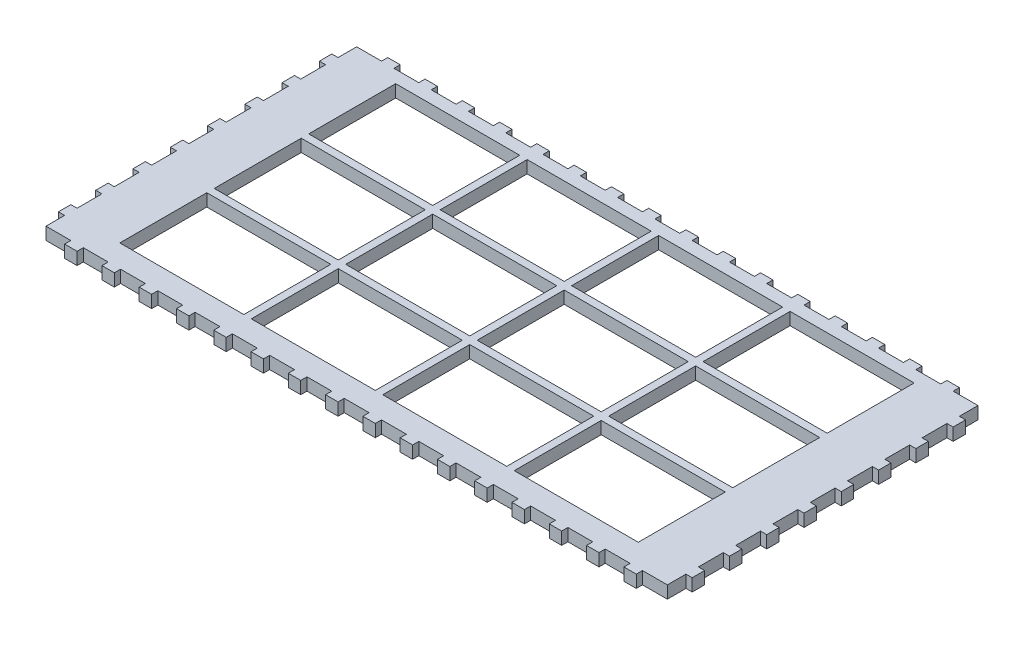
from build123d import *

# Parameters (mm, degrees)
SKETCH7_W           = 635
SKETCH7_H           = 317.5
SKETCH7_W_2         = 126.746
SKETCH7_H_2         = 88.9
BOSS_EXTRUDE4_DEPTH = 12.7
SKETCH8_W           = 12.7
SKETCH8_H           = 6.35
SKETCH8_W_2         = 6.35
SKETCH8_H_2         = 12.7
BOSS_EXTRUDE5_DEPTH = 12.7


with BuildPart() as part:
    # Sketch7 → Boss-Extrude4 (new body)
    with BuildSketch(Plane(origin=(0, 0, 0), x_dir=(1, 0, 0), z_dir=(0, 1, 0))):
        Rectangle(SKETCH7_W, SKETCH7_H)
        with Locations((-67.183, 101.6)):
            Rectangle(SKETCH7_W_2, SKETCH7_H_2, mode=Mode.SUBTRACT)
        with Locations((-201.549, 101.6)):
            Rectangle(SKETCH7_W_2, SKETCH7_H_2, mode=Mode.SUBTRACT)
        with Locations((67.183, 101.6)):
            Rectangle(SKETCH7_W_2, SKETCH7_H_2, mode=Mode.SUBTRACT)
        with Locations((-201.549, -91.44)):
            Rectangle(SKETCH7_W_2, SKETCH7_H_2, mode=Mode.SUBTRACT)
        with Locations((-67.183, -91.44)):
            Rectangle(SKETCH7_W_2, SKETCH7_H_2, mode=Mode.SUBTRACT)
        with Locations((67.183, -91.44)):
            Rectangle(SKETCH7_W_2, SKETCH7_H_2, mode=Mode.SUBTRACT)
        with Locations((-67.183, 5.08)):
            Rectangle(SKETCH7_W_2, SKETCH7_H_2, mode=Mode.SUBTRACT)
        with Locations((67.183, 5.08)):
            Rectangle(SKETCH7_W_2, SKETCH7_H_2, mode=Mode.SUBTRACT)
        with Locations((201.549, 101.6)):
            Rectangle(SKETCH7_W_2, SKETCH7_H_2, mode=Mode.SUBTRACT)
        with Locations((201.549, 5.08)):
            Rectangle(SKETCH7_W_2, SKETCH7_H_2, mode=Mode.SUBTRACT)
        with Locations((201.549, -91.44)):
            Rectangle(SKETCH7_W_2, SKETCH7_H_2, mode=Mode.SUBTRACT)
        with Locations((-201.549, 5.08)):
            Rectangle(SKETCH7_W_2, SKETCH7_H_2, mode=Mode.SUBTRACT)
    extrude(amount=BOSS_EXTRUDE4_DEPTH)

    # Sketch8 → Boss-Extrude5 (add)
    with BuildSketch(Plane(origin=(0, 0, 0), x_dir=(1, 0, 0), z_dir=(0, 1, 0))):
        with Locations((-285.75, 161.925)):
            Rectangle(SKETCH8_W, SKETCH8_H)
        with Locations((19.05, 161.925)):
            Rectangle(SKETCH8_W, SKETCH8_H)
        with Locations((-320.675, 133.35)):
            Rectangle(SKETCH8_W_2, SKETCH8_H_2)
        with Locations((-320.675, 95.25)):
            Rectangle(SKETCH8_W_2, SKETCH8_H_2)
        with Locations((-320.675, 57.15)):
            Rectangle(SKETCH8_W_2, SKETCH8_H_2)
        with Locations((-320.675, 19.05)):
            Rectangle(SKETCH8_W_2, SKETCH8_H_2)
        with Locations((-320.675, -19.05)):
            Rectangle(SKETCH8_W_2, SKETCH8_H_2)
        with Locations((-320.675, -57.15)):
            Rectangle(SKETCH8_W_2, SKETCH8_H_2)
        with Locations((-320.675, -95.25)):
            Rectangle(SKETCH8_W_2, SKETCH8_H_2)
        with Locations((-320.675, -133.35)):
            Rectangle(SKETCH8_W_2, SKETCH8_H_2)
        with Locations((-247.65, 161.925)):
            Rectangle(SKETCH8_W, SKETCH8_H)
        with Locations((-209.55, 161.925)):
            Rectangle(SKETCH8_W, SKETCH8_H)
        with Locations((-171.45, 161.925)):
            Rectangle(SKETCH8_W, SKETCH8_H)
        with Locations((-133.35, 161.925)):
            Rectangle(SKETCH8_W, SKETCH8_H)
        with Locations((-95.25, 161.925)):
            Rectangle(SKETCH8_W, SKETCH8_H)
        with Locations((-57.15, 161.925)):
            Rectangle(SKETCH8_W, SKETCH8_H)
        with Locations((-19.05, 161.925)):
            Rectangle(SKETCH8_W, SKETCH8_H)
        with Locations((57.15, 161.925)):
            Rectangle(SKETCH8_W, SKETCH8_H)
        with Locations((95.25, 161.925)):
            Rectangle(SKETCH8_W, SKETCH8_H)
        with Locations((133.35, 161.925)):
            Rectangle(SKETCH8_W, SKETCH8_H)
        with Locations((171.45, 161.925)):
            Rectangle(SKETCH8_W, SKETCH8_H)
        with Locations((209.55, 161.925)):
            Rectangle(SKETCH8_W, SKETCH8_H)
        with Locations((247.65, 161.925)):
            Rectangle(SKETCH8_W, SKETCH8_H)
        with Locations((285.75, 161.925)):
            Rectangle(SKETCH8_W, SKETCH8_H)
        with Locations((320.675, -133.35)):
            Rectangle(SKETCH8_W_2, SKETCH8_H_2)
        with Locations((320.675, -95.25)):
            Rectangle(SKETCH8_W_2, SKETCH8_H_2)
        with Locations((320.675, -57.15)):
            Rectangle(SKETCH8_W_2, SKETCH8_H_2)
        with Locations((320.675, -19.05)):
            Rectangle(SKETCH8_W_2, SKETCH8_H_2)
        with Locations((320.675, 19.05)):
            Rectangle(SKETCH8_W_2, SKETCH8_H_2)
        with Locations((320.675, 57.15)):
            Rectangle(SKETCH8_W_2, SKETCH8_H_2)
        with Locations((320.675, 95.25)):
            Rectangle(SKETCH8_W_2, SKETCH8_H_2)
        with Locations((320.675, 133.35)):
            Rectangle(SKETCH8_W_2, SKETCH8_H_2)
        with Locations((285.75, -161.925)):
            Rectangle(SKETCH8_W, SKETCH8_H)
        with Locations((247.65, -161.925)):
            Rectangle(SKETCH8_W, SKETCH8_H)
        with Locations((209.55, -161.925)):
            Rectangle(SKETCH8_W, SKETCH8_H)
        with Locations((171.45, -161.925)):
            Rectangle(SKETCH8_W, SKETCH8_H)
        with Locations((133.35, -161.925)):
            Rectangle(SKETCH8_W, SKETCH8_H)
        with Locations((95.25, -161.925)):
            Rectangle(SKETCH8_W, SKETCH8_H)
        with Locations((57.15, -161.925)):
            Rectangle(SKETCH8_W, SKETCH8_H)
        with Locations((19.05, -161.925)):
            Rectangle(SKETCH8_W, SKETCH8_H)
        with Locations((-19.05, -161.925)):
            Rectangle(SKETCH8_W, SKETCH8_H)
        with Locations((-57.15, -161.925)):
            Rectangle(SKETCH8_W, SKETCH8_H)
        with Locations((-95.25, -161.925)):
            Rectangle(SKETCH8_W, SKETCH8_H)
        with Locations((-133.35, -161.925)):
            Rectangle(SKETCH8_W, SKETCH8_H)
        with Locations((-171.45, -161.925)):
            Rectangle(SKETCH8_W, SKETCH8_H)
        with Locations((-209.55, -161.925)):
            Rectangle(SKETCH8_W, SKETCH8_H)
        with Locations((-247.65, -161.925)):
            Rectangle(SKETCH8_W, SKETCH8_H)
        with Locations((-285.75, -161.925)):
            Rectangle(SKETCH8_W, SKETCH8_H)
    extrude(amount=BOSS_EXTRUDE5_DEPTH)


solid = part.part
